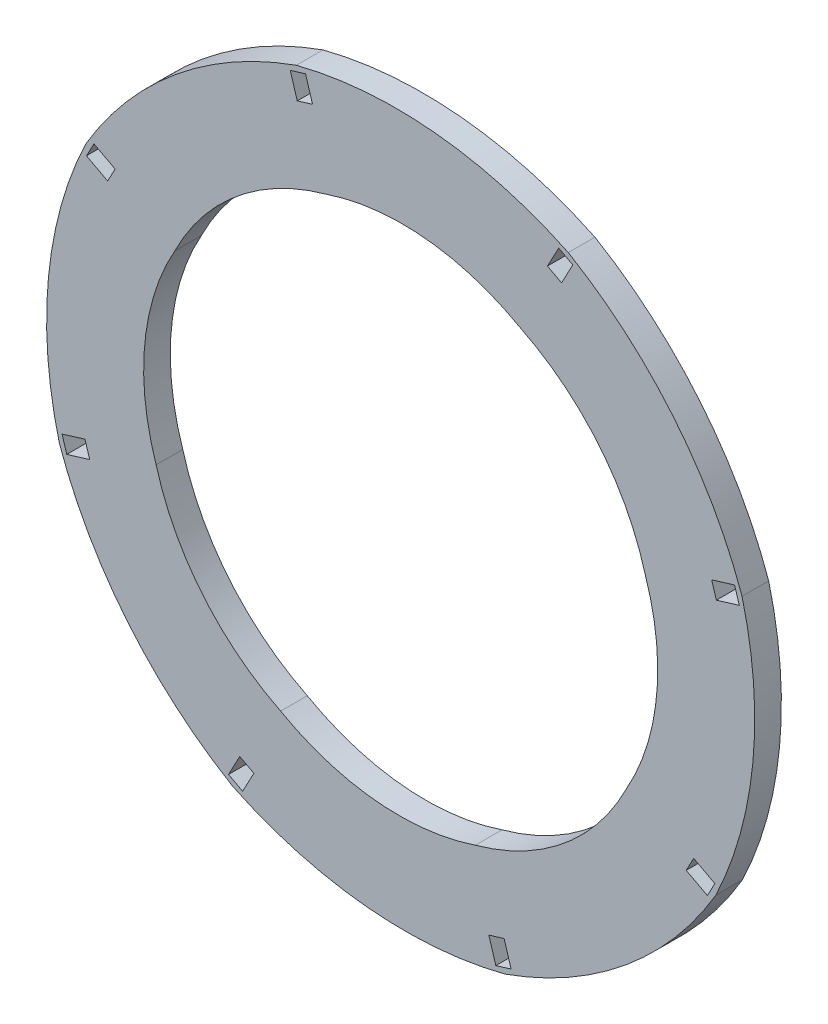
from build123d import *

# Parameters (mm, degrees)
EXTRUDE_1_DEPTH          = 10
PATTERN_CIRCULAR_1_COUNT = 8


with BuildPart() as part:
    # 草图1 → 凸台-拉伸1 (new body)
    with BuildSketch(Plane.XY):
        with BuildLine():
            Line((142.543194713, 319.58457711), (129.866098291, 295.745717525))
            Line((129.866098291, 295.745717525), (132.514860467, 294.337151256))
            Line((132.514860467, 294.337151256), (128.28916166, 286.390864728))
            Line((128.28916166, 286.390864728), (125.640399483, 287.799430997))
            Line((125.640399483, 287.799430997), (124.701355304, 286.033589546))
            ThreePointArc((124.701355304, 286.033589546), (174.869094963, 272.123990236), (226.769655421, 276.199634915))
            Line((226.769655421, 276.199634915), (226.185021463, 278.112277886))
            Line((226.185021463, 278.112277886), (223.316057006, 277.23532695))
            Line((223.316057006, 277.23532695), (220.685204199, 285.842220321))
            Line((220.685204199, 285.842220321), (223.554168656, 286.719171257))
            Line((223.554168656, 286.719171257), (215.661610233, 312.539851371))
            ThreePointArc((215.661610233, 312.539851371), (178.350963885, 308.262904384), (142.543194713, 319.58457711))
        make_face()
    extrude_1 = extrude(amount=EXTRUDE_1_DEPTH)

    # 阵列(圆周)1: 凸台-拉伸1 ×8 about axis
    pattern_circular_1_axis = Axis((187.606138684, 404.323949445, 10), (0, 0, -1))
    for i in range(1, PATTERN_CIRCULAR_1_COUNT):
        add(extrude_1.rotate(pattern_circular_1_axis, i * 360 / PATTERN_CIRCULAR_1_COUNT))


solid = part.part
